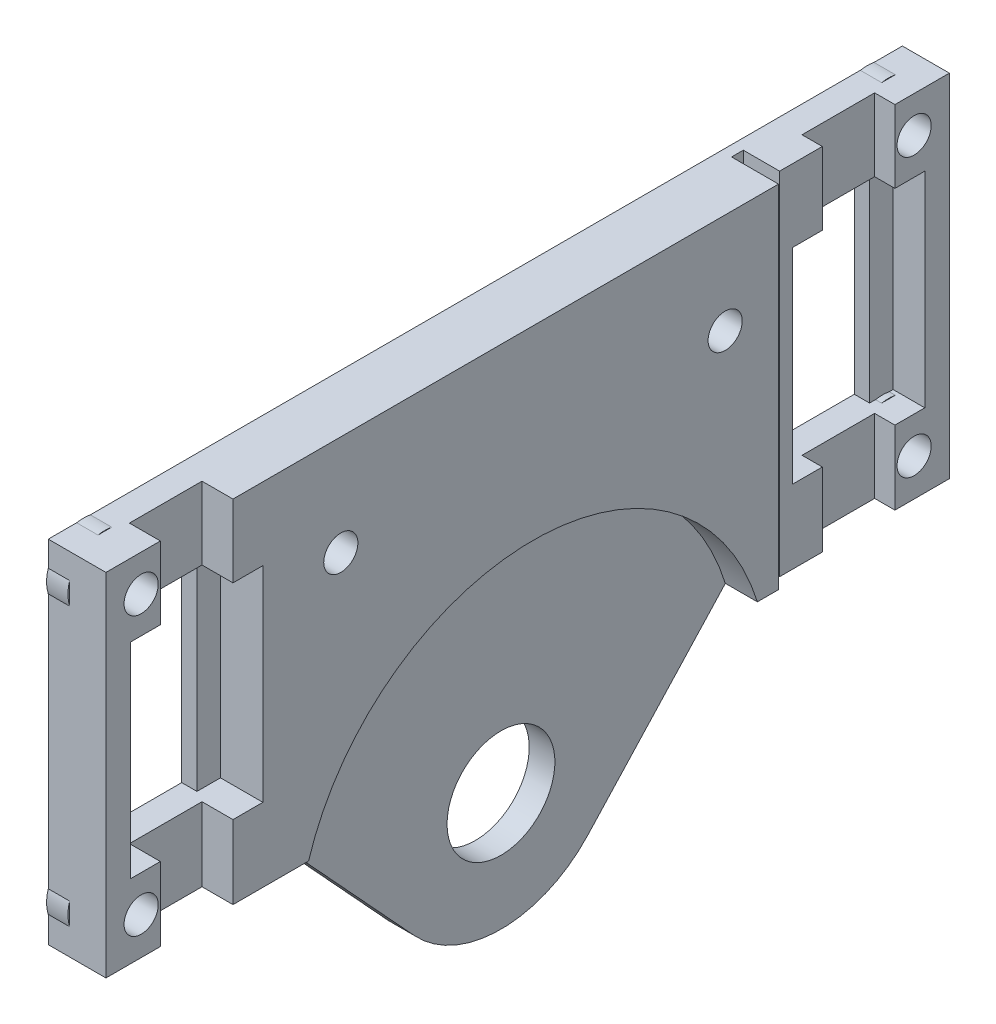
from build123d import *
from build123d.topology import SkipClean

# Parameters (mm, degrees)
ESQUISSE2_W                                       = 80
ESQUISSE2_H                                       = 85
PLAQUE_DEPTH                                      = 5.4
ESQUISSE15_R                                      = 22
D_GAGEMENT_ROUE_DEPTH                             = 81.678373806
D_COUPE_INF_RIEURE_DEPTH                          = 81.803217758
ESQUISSE14_R                                      = 11.05
ESQUISSE14_R_2                                    = 5.05
RENFORT_ROULEMENT_DEPTH                           = 2.4
D_COUPE_SUP_RIEURE_DEPTH                          = 81.803217758
D_GAGEMENT_AXE_6_DEPTH                            = 75.400336021
D_GAGEMENT_AXE_6_DEPTH_BACK                       = 75.400336021
ESQUISSE26_W                                      = 6.8
ESQUISSE26_H                                      = 6.8
D_GAGEMENT_START                                  = 1.4
D_GAGEMENT_DOUILLE_DEPTH                          = 19.2
R_P_TITION_LIN_AIRE1_COUNT                        = 2
R_P_TITION_LIN_AIRE1_PITCH                        = 26
MORS_D_FORMABLE_DOUILLE_DEPTH                     = 75.400336021
MORS_D_FORMABLE_DOUILLE_DEPTH_BACK                = 75.400336021
FRAISAGE_POUR_VIS_T_TE_FRAIS_E_BOMB_E_D           = 3.2
FRAISAGE_POUR_VIS_T_TE_FRAIS_E_BOMB_E_CSINK_D     = 6.92
FRAISAGE_POUR_VIS_T_TE_FRAIS_E_BOMB_E_CSINK_ANGLE = 90
ESQUISSE31_W                                      = 80
ESQUISSE31_H                                      = 35.1
ENL_V_MAT_EXTRU_1_DEPTH                           = 5.4
BOSS_EXTRU_1_DEPTH                                = 2.4
BOSS_EXTRU_3_START                                = -2
ESQUISSE34_R                                      = 3.46
ESQUISSE34_R_2                                    = 1.6
BOSS_EXTRU_3_DEPTH                                = 2


with BuildPart() as part:
    # Esquisse2 → plaque (new body)
    with BuildSketch(Plane(origin=(0, 0, 0), x_dir=(0, 0, -1), z_dir=(1, 0, 0))):
        with Locations((0, 27.5)):
            Rectangle(ESQUISSE2_W, ESQUISSE2_H)
    extrude(amount=PLAQUE_DEPTH)

    # Esquisse15 → dégagement roue (cut, through all)
    with BuildSketch(Plane.ZY.offset(-2.4)):
        with Locations((0, -12)):
            Circle(ESQUISSE15_R)
    extrude(amount=-D_GAGEMENT_ROUE_DEPTH, mode=Mode.SUBTRACT)

    # Esquisse18 → découpe_inférieure (cut, through all)
    with BuildSketch(Plane(origin=(0, 0, 0), x_dir=(0, 0, -1), z_dir=(1, 0, 0))):
        Polygon((-7.446869682, -5.5), (-40, -5.5), (-40, -15), (40, -15), (40, -5.5), (7.446869682, -5.5), align=None)
    extrude(amount=D_COUPE_INF_RIEURE_DEPTH, mode=Mode.SUBTRACT)

    # Esquisse14 → renfort_roulement (add)
    with BuildSketch(Plane(origin=(0, 0, 0), x_dir=(0, 0, -1), z_dir=(1, 0, 0))):
        with Locations((0, -12)):
            Circle(ESQUISSE14_R)
        with Locations((0, -12)):
            Circle(ESQUISSE14_R_2, mode=Mode.SUBTRACT)
    extrude(amount=RENFORT_ROULEMENT_DEPTH)

    # Esquisse20 → découpe_supérieure (cut, through all)
    with BuildSketch(Plane(origin=(0, 0, 0), x_dir=(0, 0, -1), z_dir=(1, 0, 0))):
        with BuildLine():
            Line((-40, 70), (40, 70))
            Line((40, 70), (40, 62.5))
            Line((40, 62.5), (26, 62.5))
            ThreePointArc((26, 62.5), (22.956192855, 61.466766701), (21.170370869, 58.794095226))
            Line((21.170370869, 58.794095226), (15.559208556, 37.852952387))
            ThreePointArc((15.559208556, 37.852952387), (14.666297563, 36.516616649), (13.144393991, 36))
            Line((13.144393991, 36), (-13.144393991, 36))
            ThreePointArc((-13.144393991, 36), (-14.666297563, 36.516616649), (-15.559208556, 37.852952387))
            Line((-15.559208556, 37.852952387), (-21.170370869, 58.794095226))
            ThreePointArc((-21.170370869, 58.794095226), (-22.956192855, 61.466766701), (-26, 62.5))
            Line((-26, 62.5), (-40, 62.5))
            Line((-40, 62.5), (-40, 70))
        make_face()
    extrude(amount=D_COUPE_SUP_RIEURE_DEPTH, mode=Mode.SUBTRACT)

    # Esquisse26 → dégagement axe 6 (cut, two sides: drawn at the far end of the back side and taken through both)
    with BuildSketch(Plane(origin=(0, 0, 0), x_dir=(1, 0, 0), z_dir=(0, 1, 0)).offset(-D_GAGEMENT_AXE_6_DEPTH_BACK)):
        with Locations((5.9, 31.5)):
            Rectangle(ESQUISSE26_W, ESQUISSE26_H)
        with Locations((5.9, -31.5)):
            Rectangle(ESQUISSE26_W, ESQUISSE26_H)
    extrude(amount=D_GAGEMENT_AXE_6_DEPTH + D_GAGEMENT_AXE_6_DEPTH_BACK, mode=Mode.SUBTRACT)

    # Esquisse28 → dégagement douille (cut)
    with BuildSketch(Plane(origin=(0, 0, 0), x_dir=(1, 0, 0), z_dir=(0, 1, 0)).offset(D_GAGEMENT_START)):
        Polygon((0, 35.5), (1.427864045, 35.5), (1.427864045, 37.7), (10.372135955, 37.7), (10.372135955, 25.3), (1.427864045, 25.3), (1.427864045, 27.5), (0, 27.5), align=None)
        Polygon((10.372135955, -25.3), (1.427864045, -25.3), (1.427864045, -27.5), (0, -27.5), (0, -35.5), (1.427864045, -35.5), (1.427864045, -37.7), (10.372135955, -37.7), align=None)
    d_gagement_douille = extrude(amount=D_GAGEMENT_DOUILLE_DEPTH, mode=Mode.SUBTRACT)

    # Répétition linéaire1: dégagement douille ×2
    with Locations(*[(0, i * R_P_TITION_LIN_AIRE1_PITCH, 0) for i in range(1, R_P_TITION_LIN_AIRE1_COUNT)]):
        add(d_gagement_douille, mode=Mode.SUBTRACT)

    # Esquisse19 → Mors_déformable_douille (cut, two sides: drawn at the far end of the back side and taken through both)
    with BuildSketch(Plane(origin=(0, 0, 0), x_dir=(1, 0, 0), z_dir=(0, 1, 0)).offset(-MORS_D_FORMABLE_DOUILLE_DEPTH_BACK)):
        Polygon((5.4, 40), (4.4, 40), (4.4, 24.1), (1, 24.1), (1, 23), (5.4, 23), align=None)
    extrude(amount=MORS_D_FORMABLE_DOUILLE_DEPTH + MORS_D_FORMABLE_DOUILLE_DEPTH_BACK, mode=Mode.SUBTRACT)

    # Fraisage pour vis à tête fraisée bombée fendue M31 (through all)
    with Locations(Plane.ZY):
        with Locations((18, 18), (36.7, 24), (36.7, -2), (21, 34)):
            fraisage_pour_vis_t_te_frais_e_bomb_e = CounterSinkHole(FRAISAGE_POUR_VIS_T_TE_FRAIS_E_BOMB_E_D / 2, FRAISAGE_POUR_VIS_T_TE_FRAIS_E_BOMB_E_CSINK_D / 2, counter_sink_angle=FRAISAGE_POUR_VIS_T_TE_FRAIS_E_BOMB_E_CSINK_ANGLE)

    # Esquisse31 → Enlèv. mat.-Extru.1 (cut)
    with BuildSketch(Plane(origin=(5.4, 0, 0), x_dir=(0, 0, -1), z_dir=(1, 0, 0))):
        with Locations((0, 44.95)):
            Rectangle(ESQUISSE31_W, ESQUISSE31_H)
    extrude(amount=-ENL_V_MAT_EXTRU_1_DEPTH, mode=Mode.SUBTRACT)

    # Esquisse33 → Boss.-Extru.1 (add)
    with BuildSketch(Plane(origin=(2.4, 0, 0), x_dir=(0, 0, -1), z_dir=(1, 0, 0))):
        Polygon((-8.125418007, -19.488663579), (-21.017849557, -5.5), (-8.936022605, -5.5), align=None)
        Polygon((8.125418007, -19.488663579), (21.017849557, -5.5), (8.936022605, -5.5), align=None)
    extrude(amount=-BOSS_EXTRU_1_DEPTH)

    # Symétrie4: Fraisage pour vis à tête fraisée bombée fendue M31 across plane
    add(fraisage_pour_vis_t_te_frais_e_bomb_e.mirror(Plane.XY), mode=Mode.SUBTRACT)

    # Esquisse34 → Boss.-Extru.3 (add)
    # profile 1 of 6: a face of its own
    with SkipClean():  # the faces are left unmerged after this step: merging them gives an invalid solid
        with BuildSketch(Plane.ZY.offset(BOSS_EXTRU_3_START)):
            with Locations((-36.7, 24)):
                Circle(ESQUISSE34_R)
            with Locations((-36.7, 24)):
                Circle(ESQUISSE34_R_2, mode=Mode.SUBTRACT)
        # profile 2 of 6: a face of its own
        with BuildSketch(Plane.ZY.offset(BOSS_EXTRU_3_START)):
            with Locations((-36.7, -2)):
                Circle(ESQUISSE34_R)
            with Locations((-36.7, -2)):
                Circle(ESQUISSE34_R_2, mode=Mode.SUBTRACT)
        # profile 3 of 6: a face of its own
        with BuildSketch(Plane.ZY.offset(BOSS_EXTRU_3_START)):
            with Locations((-18, 18)):
                Circle(ESQUISSE34_R)
            with Locations((-18, 18)):
                Circle(ESQUISSE34_R_2, mode=Mode.SUBTRACT)
        # profile 4 of 6: a face of its own
        with BuildSketch(Plane.ZY.offset(BOSS_EXTRU_3_START)):
            with Locations((18, 18)):
                Circle(ESQUISSE34_R)
            with Locations((18, 18)):
                Circle(ESQUISSE34_R_2, mode=Mode.SUBTRACT)
        # profile 5 of 6: a face of its own
        with BuildSketch(Plane.ZY.offset(BOSS_EXTRU_3_START)):
            with Locations((36.7, -2)):
                Circle(ESQUISSE34_R)
            with Locations((36.7, -2)):
                Circle(ESQUISSE34_R_2, mode=Mode.SUBTRACT)
        # profile 6 of 6: a face of its own
        with BuildSketch(Plane.ZY.offset(BOSS_EXTRU_3_START)):
            with Locations((36.7, 24)):
                Circle(ESQUISSE34_R)
            with Locations((36.7, 24)):
                Circle(ESQUISSE34_R_2, mode=Mode.SUBTRACT)
        extrude(amount=BOSS_EXTRU_3_DEPTH)


solid = part.part
